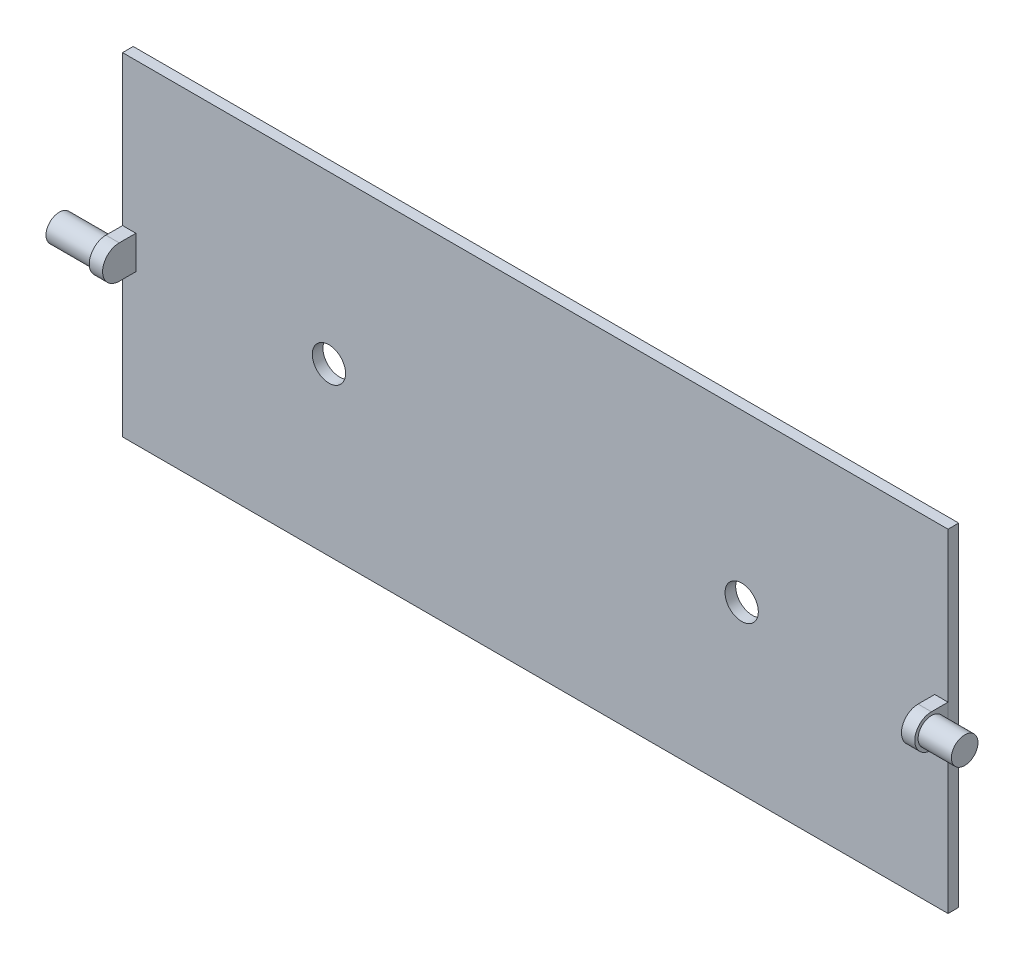
from build123d import *

# Parameters (mm, degrees)
SKETCH1_W           = 620
SKETCH1_H           = 250
BOSS_EXTRUDE1_DEPTH = 8
SKETCH2_R           = 12.5
CUT_EXTRUDE1_DEPTH  = 8
BOSS_EXTRUDE2_DEPTH = 10
SKETCH4_R           = 10
BOSS_EXTRUDE3_DEPTH = 25
SKETCH5_R           = 10
BOSS_EXTRUDE4_DEPTH = 35


with BuildPart() as part:
    # Sketch1 → Boss-Extrude1 (new body)
    with BuildSketch(Plane.XY):
        Rectangle(SKETCH1_W, SKETCH1_H)
    extrude(amount=BOSS_EXTRUDE1_DEPTH)

    # Sketch2 → Cut-Extrude1 (cut)
    with BuildSketch(Plane.XY.offset(8)):
        with Locations((155, 0)):
            Circle(SKETCH2_R)
        with Locations(Location((-155, 0, 0), (0, 0, 180))):
            Circle(SKETCH2_R)
    extrude(amount=-CUT_EXTRUDE1_DEPTH, mode=Mode.SUBTRACT)


with BuildPart() as body_2:
    # Sketch3 → Boss-Extrude2 (new body)
    with BuildSketch(Plane(origin=(310, 0, 0), x_dir=(0, 0, -1), z_dir=(1, 0, 0))):
        with BuildLine():
            Line((-20.5, 12.5), (-8, 12.5))
            Line((-8, 12.5), (-8, -12.5))
            Line((-8, -12.5), (-20.5, -12.5))
            ThreePointArc((-20.5, -12.5), (-33, 0), (-20.5, 12.5))
        make_face()
    boss_extrude2 = extrude(amount=-BOSS_EXTRUDE2_DEPTH)


with BuildPart() as body_3:
    # Sketch4 → Boss-Extrude3 (new body)
    with BuildSketch(Plane(origin=(310, 0, 0), x_dir=(0, 0, -1), z_dir=(1, 0, 0))):
        with Locations((-20.5, 0)):
            Circle(SKETCH4_R)
    extrude(amount=BOSS_EXTRUDE3_DEPTH)


with BuildPart() as part_1:
    add(part.part)

    # Mirror2: Boss-Extrude2 across plane
    add(boss_extrude2.mirror(Plane(origin=(0, 0, 0), x_dir=(0, 0, 1), z_dir=(1, 0, 0))))


with BuildPart() as body_4:
    # Sketch5 → Boss-Extrude4 (new body)
    with BuildSketch(Plane.ZY.offset(310)):
        with Locations((20.5, 0)):
            Circle(SKETCH5_R)
    extrude(amount=BOSS_EXTRUDE4_DEPTH)


solid = Compound([body_2.part, body_3.part, part_1.part, body_4.part])
